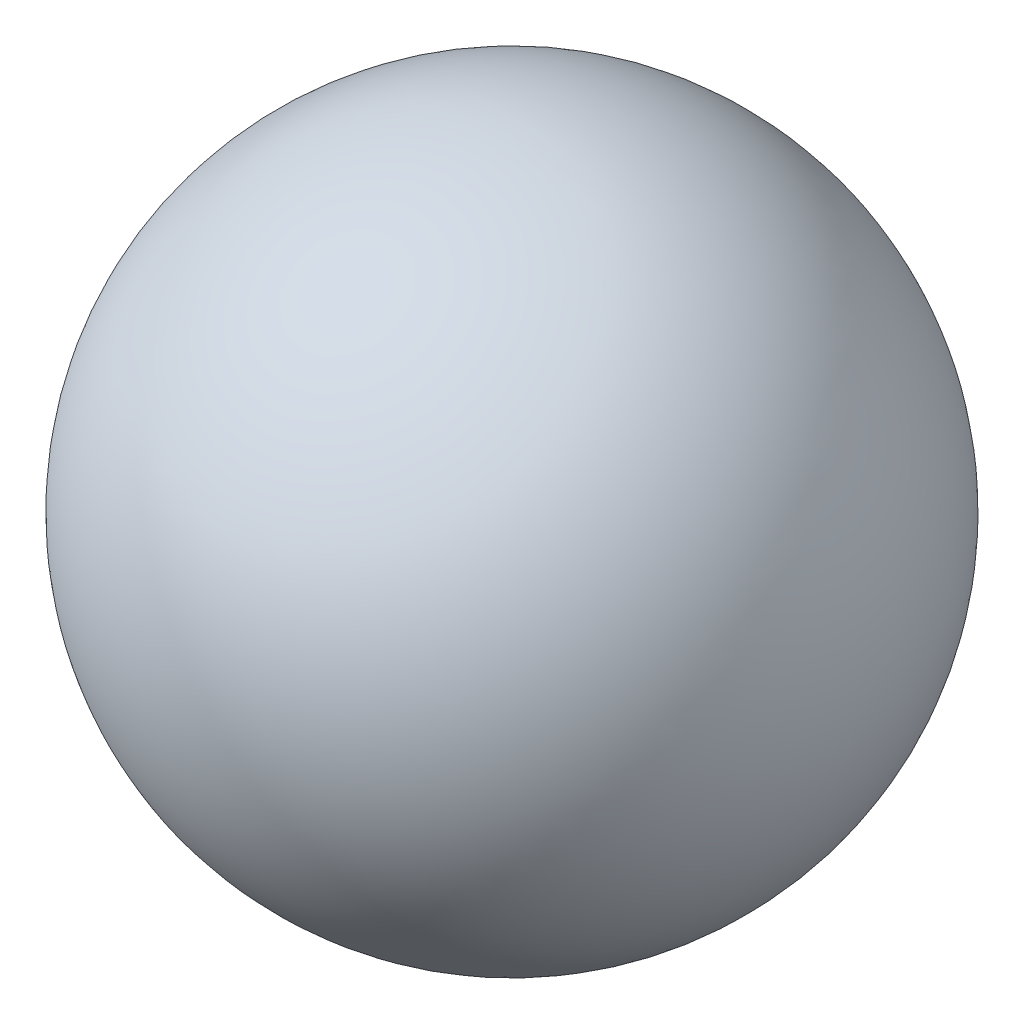
from build123d import *
from build123d.topology import SkipClean


with BuildPart() as part:
    # Sketch1 → Revolve2 (revolve)
    with SkipClean():  # the faces are left unmerged after this step: merging them gives an invalid solid
        with BuildSketch(Plane(origin=(0, 0, 0), x_dir=(1, 0, 0), z_dir=(0, 1, 0))):
            with BuildLine():
                ThreePointArc((7, 0), (4.949747468, 4.949747468), (0, 7))
                Line((0, 7), (0, -7))
                ThreePointArc((0, -7), (4.949747468, -4.949747468), (7, 0))
            make_face()
            with BuildLine():
                Line((0, -7), (0, 7))
                ThreePointArc((0, 7), (-7, 0), (0, -7))
            make_face()
        revolve(axis=Axis((0, 0, -7), (0, 0, 1)))


solid = part.part
